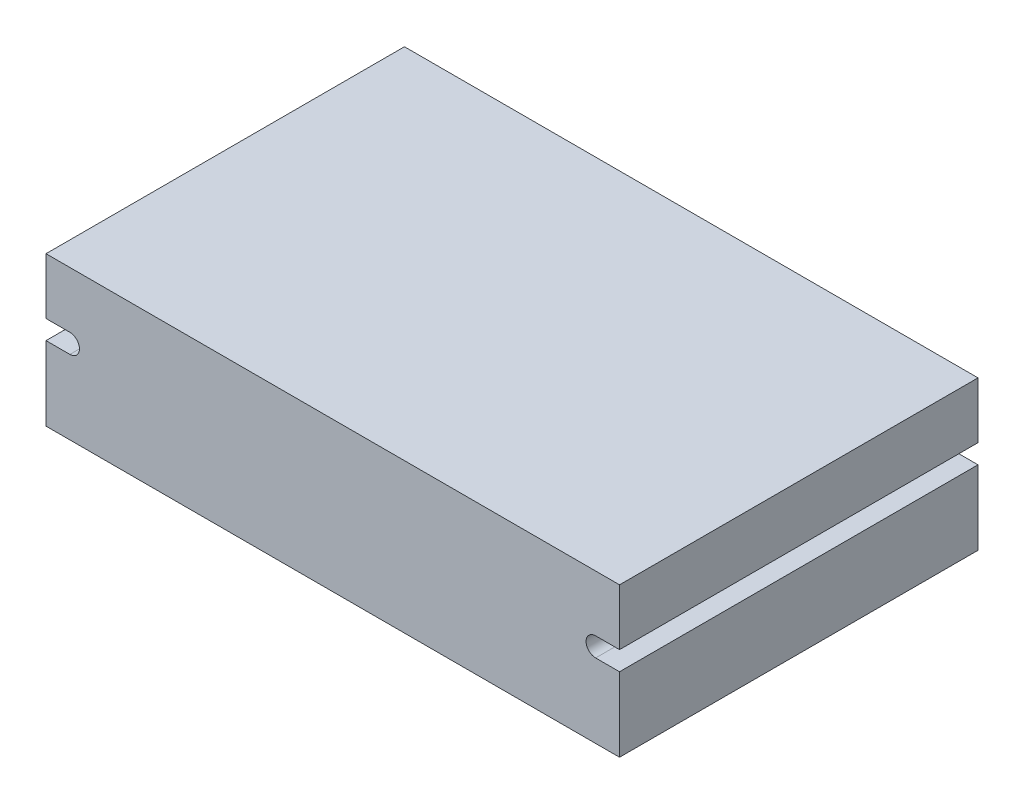
from build123d import *

# Parameters (mm, degrees)
ESTRUSIONE_ESTRUSIONE1_DEPTH = 60


with BuildPart() as part:
    # Schizzo1 → Estrusione-Estrusione1 (new body)
    with BuildSketch(Plane.XY):
        with BuildLine():
            Line((0, 0), (96, 0))
            Line((96, 0), (96, 12.398749749))
            Line((96, 12.398749749), (92, 12.398749749))
            ThreePointArc((92, 12.398749749), (90.398749749, 14), (92, 15.601250251))
            Line((92, 15.601250251), (96, 15.601250251))
            Line((96, 15.601250251), (96, 25))
            Line((96, 25), (0, 25))
            Line((0, 25), (0, 15.601250251))
            Line((0, 15.601250251), (4, 15.601250251))
            ThreePointArc((4, 15.601250251), (5.601250251, 14), (4, 12.398749749))
            Line((4, 12.398749749), (0, 12.398749749))
            Line((0, 12.398749749), (0, 0))
        make_face()
    extrude(amount=ESTRUSIONE_ESTRUSIONE1_DEPTH)


solid = part.part
